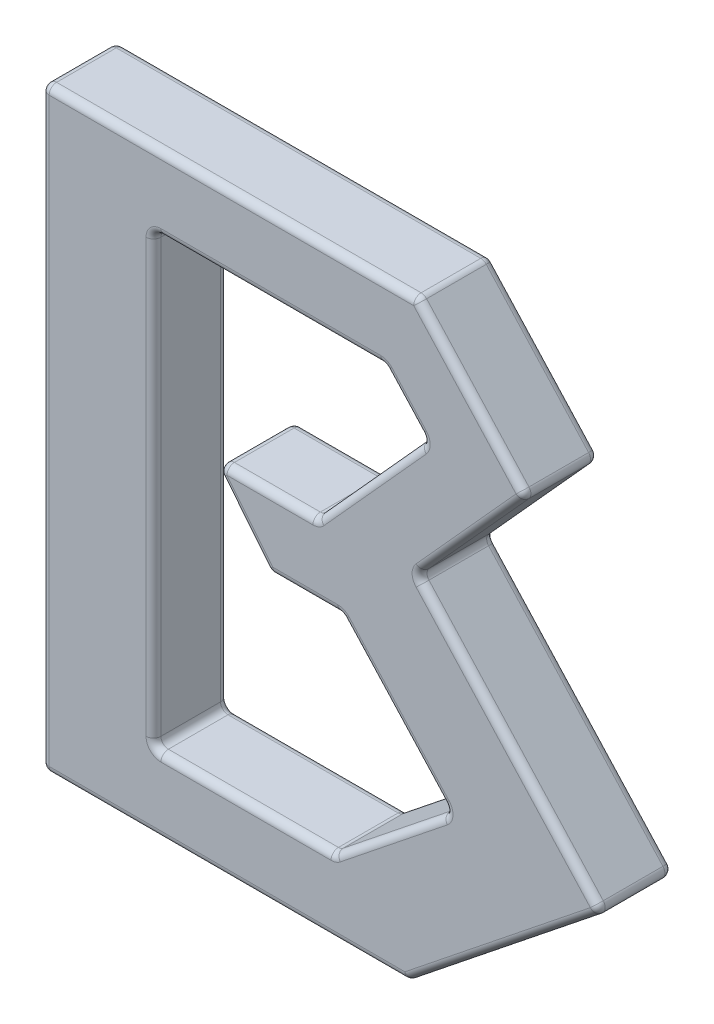
from build123d import *

# Parameters (mm, degrees)
BOSS_EXTRUDE1_DEPTH = 10
FILLET1_R           = 1


with BuildPart() as part:
    # Sketch1 → Boss-Extrude1 (new body)
    with BuildSketch(Plane.XY):
        Polygon((0, 0), (0, 80), (50.35636843, 80), (65, 64), (50.35636843, 47.801028246), (75.082691126, 20.784426439), (49.086671835, 0), align=None)
        Polygon((15, 70), (15, 10), (39.175041513, 10), (54.650471107, 22.372968508), (40.201134066, 38.160677422), (30.540668467, 38.160677422), (22.767507003, 47.759448109), (36.838464072, 47.759448109), (51.482095642, 63.958419863), (45.95267854, 70), align=None, mode=Mode.SUBTRACT)
    extrude(amount=-BOSS_EXTRUDE1_DEPTH)

    # Fillet1
    fillet1_edges = [part.edges().sort_by_distance(p)[0] for p in [
        (24.543335918, 0, -10),
        (62.084681481, 10.39221322, -10),
        (26.654087735, 42.960062765, 0),
        (29.802985537, 47.759448109, 0),
        (44.160279857, 55.858933986, 0),
        (48.717387091, 66.979209931, 0),
        (30.47633927, 70, 0),
        (15, 40, 0),
        (62.719529778, 34.292727343, -10),
        (27.087520757, 10, 0),
        (46.91275631, 16.186484254, 0),
        (47.425802587, 30.266822965, 0),
        (35.370901266, 38.160677422, 0),
        (25.178184215, 80, 0),
        (57.678184215, 72, 0),
        (57.678184215, 55.900514123, 0),
        (62.719529778, 34.292727343, 0),
        (62.084681481, 10.39221322, 0),
        (24.543335918, 0, 0),
        (57.678184215, 55.900514123, -10),
        (0, 40, 0),
        (57.678184215, 72, -10),
        (30.540668467, 38.160677422, -5),
        (22.767507003, 47.759448109, -5),
        (36.838464072, 47.759448109, -5),
        (51.482095642, 63.958419863, -5),
        (45.95267854, 70, -5),
        (15, 70, -5),
        (15, 10, -5),
        (39.175041513, 10, -5),
        (54.650471107, 22.372968508, -5),
        (40.201134066, 38.160677422, -5),
        (0, 80, -5),
        (50.35636843, 80, -5),
        (65, 64, -5),
        (50.35636843, 47.801028246, -5),
        (75.082691126, 20.784426439, -5),
        (49.086671835, 0, -5),
        (0, 0, -5),
        (25.178184215, 80, -10),
        (35.370901266, 38.160677422, -10),
        (47.425802587, 30.266822965, -10),
        (46.91275631, 16.186484254, -10),
        (27.087520757, 10, -10),
        (15, 40, -10),
        (30.47633927, 70, -10),
        (0, 40, -10),
        (48.717387091, 66.979209931, -10),
        (44.160279857, 55.858933986, -10),
        (29.802985537, 47.759448109, -10),
        (26.654087735, 42.960062765, -10),
    ]]
    fillet(fillet1_edges, radius=FILLET1_R)


solid = part.part
